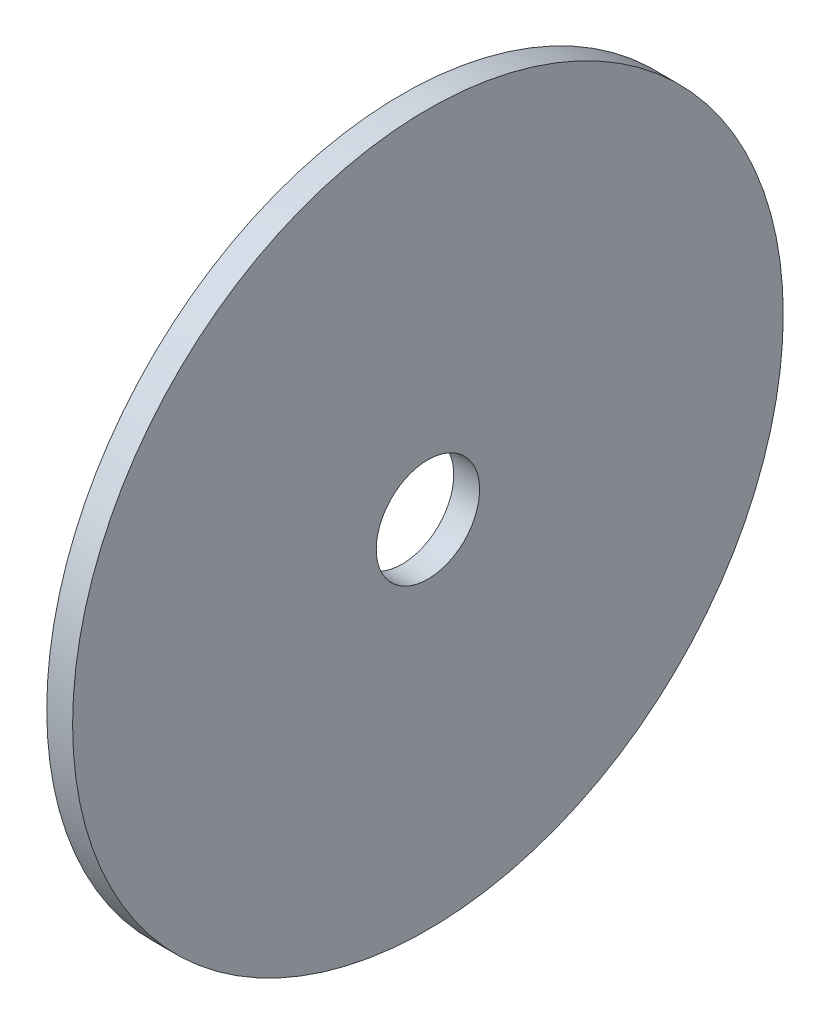
from build123d import *

# Parameters (mm, degrees)
AXIAL_PROFILE_MM_W = 4
AXIAL_PROFILE_MM_H = 47


with BuildPart() as part:
    # Axial profile (mm) → Full revolution (revolve)
    with BuildSketch(Plane.XY, mode=Mode.PRIVATE) as full_revolution_sk:
        with Locations((-128, 31.5)):
            Rectangle(AXIAL_PROFILE_MM_W, AXIAL_PROFILE_MM_H)
    revolve(full_revolution_sk.sketch.rotate(Axis((-110, 0, 0), (1, 0, 0)), 90), axis=Axis((-110, 0, 0), (1, 0, 0)))


solid = part.part
